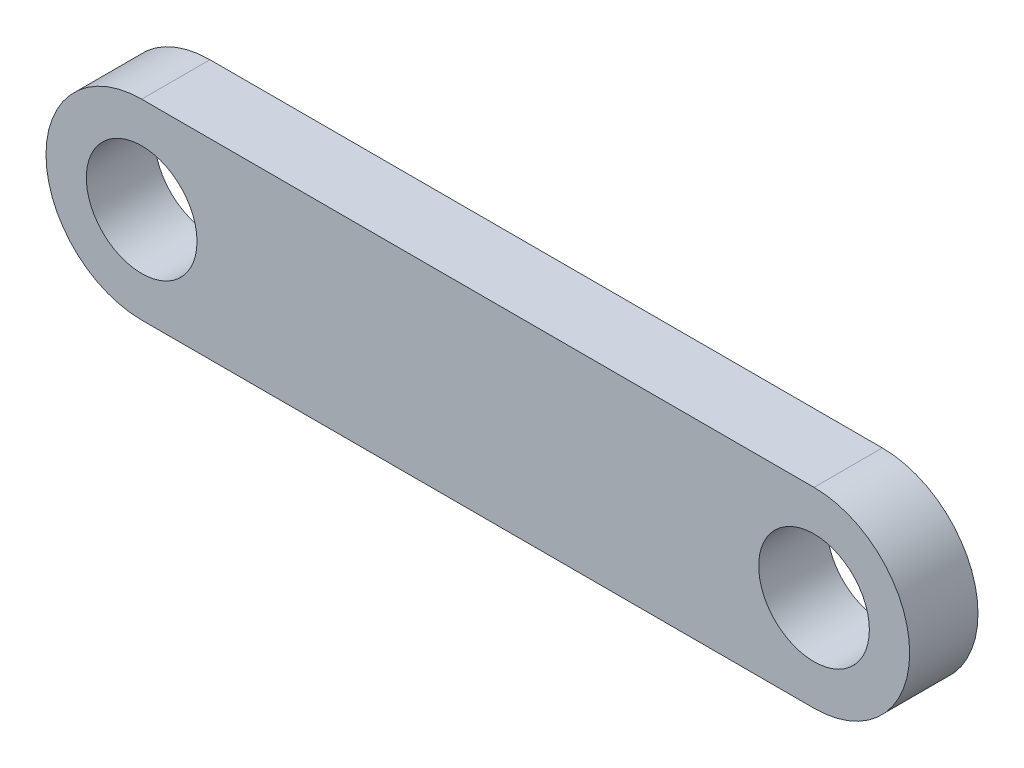
from build123d import *

# Parameters (mm, degrees)
SKETCH_1_R      = 7
SKETCH_1_R_2    = 4.05
EXTRUDE_1_DEPTH = 5


with BuildPart() as part:
    # 草图1 → 凸台-拉伸1 (new body)
    # profile 1 of 3: a face of its own
    with BuildSketch(Plane.XY):
        with BuildLine():
            ThreePointArc((7, 0), (4.949747468, -4.949747468), (0, -7))
            Line((0, -7), (49.2, -7))
            ThreePointArc((49.2, -7), (42.2, 0), (49.2, 7))
            Line((49.2, 7), (0, 7))
            ThreePointArc((0, 7), (4.949747468, 4.949747468), (7, 0))
        make_face()
    # profile 2 of 3: a face of its own
    with BuildSketch(Plane.XY):
        Circle(SKETCH_1_R)
        Circle(SKETCH_1_R_2, mode=Mode.SUBTRACT)
    # profile 3 of 3: a face of its own
    with BuildSketch(Plane.XY):
        with Locations((49.2, 0)):
            Circle(SKETCH_1_R)
        with Locations((49.2, 0)):
            Circle(SKETCH_1_R_2, mode=Mode.SUBTRACT)
    extrude(amount=EXTRUDE_1_DEPTH)


solid = part.part
